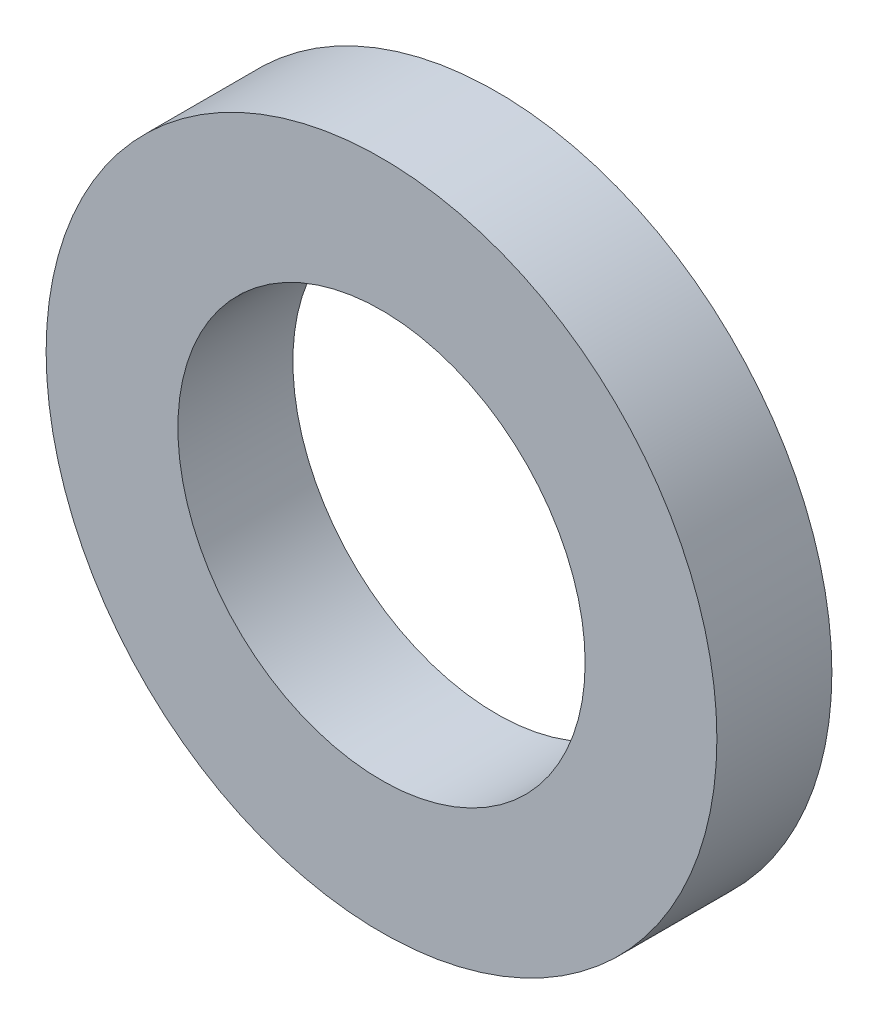
from build123d import *

# Parameters (mm, degrees)
SKETCH2_R           = 7
SKETCH2_R_2         = 4.25
BOSS_EXTRUDE1_DEPTH = 2.4


with BuildPart() as part:
    # Sketch2 → Boss-Extrude1 (new body)
    with BuildSketch(Plane.XY):
        Circle(SKETCH2_R)
        Circle(SKETCH2_R_2, mode=Mode.SUBTRACT)
    extrude(amount=BOSS_EXTRUDE1_DEPTH)


solid = part.part
